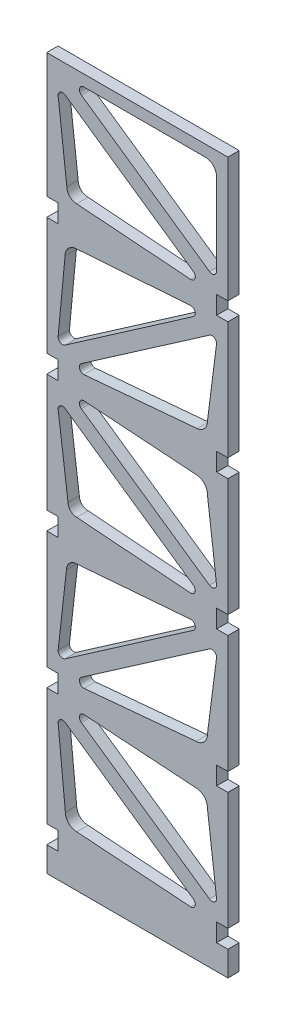
from build123d import *

# Parameters (mm, degrees)
MODEL_W             = 101.6
MODEL_H             = 398.78
BOSS_EXTRUDE1_DEPTH = 6.35
SKETCH1_W           = 6.35
SKETCH1_H           = 10.16
CUT_EXTRUDE1_DEPTH  = 6.35


with BuildPart() as part:
    # Model → Boss-Extrude1 (new body)
    with BuildSketch(Plane.XY):
        with Locations((50.8, 199.39)):
            Rectangle(MODEL_W, MODEL_H)
        with BuildLine():
            Line((83.820574672, 83.411866713), (20.83121403, 87.63))
            ThreePointArc((20.83121403, 87.63), (18.406749642, 85.847345646), (19.385420684, 83.001631833))
            Line((19.385420684, 83.001631833), (91.264206654, 33.239395393))
            ThreePointArc((91.264206654, 33.239395393), (93.888830968, 33.077884107), (95.25, 35.32776356))
            Line((95.25, 35.32776356), (90.076491123, 77.061866713))
            ThreePointArc((90.076491123, 77.061866713), (88.249801524, 81.518855344), (83.820574672, 83.411866713))
        make_face(mode=Mode.SUBTRACT)
        with BuildLine():
            Line((11.034694705, 153.003483907), (6.35, 111.52776356))
            ThreePointArc((6.35, 111.52776356), (7.711169032, 109.277884107), (10.335793346, 109.439395393))
            Line((10.335793346, 109.439395393), (82.214579316, 159.201631833))
            ThreePointArc((82.214579316, 159.201631833), (83.193250358, 162.047345646), (80.76878597, 163.83))
            Line((80.76878597, 163.83), (16.773036865, 158.741826067))
            ThreePointArc((16.773036865, 158.741826067), (12.715416211, 157.061104561), (11.034694705, 153.003483907))
        make_face(mode=Mode.SUBTRACT)
        with BuildLine():
            Line((84.100188096, 235.630146894), (20.83121403, 240.03))
            ThreePointArc((20.83121403, 240.03), (18.406749642, 238.247345646), (19.385420684, 235.401631833))
            Line((19.385420684, 235.401631833), (91.264206654, 185.639395393))
            ThreePointArc((91.264206654, 185.639395393), (93.888830968, 185.477884107), (95.25, 187.72776356))
            Line((95.25, 187.72776356), (90.086811771, 229.280146894))
            ThreePointArc((90.086811771, 229.280146894), (88.354189205, 233.643693703), (84.100188096, 235.630146894))
        make_face(mode=Mode.SUBTRACT)
        with BuildLine():
            Line((16.773036865, 181.402479512), (80.76878597, 176.53))
            ThreePointArc((80.76878597, 176.53), (83.193250358, 178.312654354), (82.214579316, 181.158368167))
            Line((82.214579316, 181.158368167), (10.335793346, 230.920604607))
            ThreePointArc((10.335793346, 230.920604607), (7.711169032, 231.082115893), (6.35, 228.83223644))
            Line((6.35, 228.83223644), (11.910018955, 186.265497422))
            ThreePointArc((11.910018955, 186.265497422), (13.334363923, 182.826824481), (16.773036865, 181.402479512))
        make_face(mode=Mode.SUBTRACT)
        with BuildLine():
            Line((91.264206654, 154.720604607), (19.385420684, 104.958368167))
            ThreePointArc((19.385420684, 104.958368167), (18.406749642, 102.112654354), (20.83121403, 100.33))
            Line((20.83121403, 100.33), (83.725783656, 106.06798896))
            ThreePointArc((83.725783656, 106.06798896), (88.215911716, 107.9278609), (90.075783656, 112.41798896))
            Line((90.075783656, 112.41798896), (95.25, 152.63223644))
            ThreePointArc((95.25, 152.63223644), (93.888830968, 154.882115893), (91.264206654, 154.720604607))
        make_face(mode=Mode.SUBTRACT)
        with BuildLine():
            Line((10.271454318, 305.232761919), (6.35, 263.92776356))
            ThreePointArc((6.35, 263.92776356), (7.711169032, 261.677884107), (10.335793346, 261.839395393))
            Line((10.335793346, 261.839395393), (82.214579316, 311.601631833))
            ThreePointArc((82.214579316, 311.601631833), (83.193250358, 314.447345646), (80.76878597, 316.23))
            Line((80.76878597, 316.23), (16.773036865, 311.734344465))
            ThreePointArc((16.773036865, 311.734344465), (12.175723757, 309.830075026), (10.271454318, 305.232761919))
        make_face(mode=Mode.SUBTRACT)
        with BuildLine():
            Line((88.9, 392.43), (20.83121403, 392.43))
            ThreePointArc((20.83121403, 392.43), (18.406749642, 390.647345646), (19.385420684, 387.801631833))
            Line((19.385420684, 387.801631833), (91.264206654, 338.039395393))
            ThreePointArc((91.264206654, 338.039395393), (93.888830968, 337.877884107), (95.25, 340.12776356))
            Line((95.25, 340.12776356), (95.25, 386.08))
            ThreePointArc((95.25, 386.08), (93.390128061, 390.570128061), (88.9, 392.43))
        make_face(mode=Mode.SUBTRACT)
        with BuildLine():
            Line((16.773036865, 333.700240414), (80.76878597, 328.93))
            ThreePointArc((80.76878597, 328.93), (83.193250358, 330.712654354), (82.214579316, 333.558368167))
            Line((82.214579316, 333.558368167), (10.335793346, 383.320604607))
            ThreePointArc((10.335793346, 383.320604607), (7.711169032, 383.482115893), (6.35, 381.23223644))
            Line((6.35, 381.23223644), (11.254237586, 339.219039692))
            ThreePointArc((11.254237586, 339.219039692), (12.870656471, 335.316659298), (16.773036865, 333.700240414))
        make_face(mode=Mode.SUBTRACT)
        with BuildLine():
            Line((16.773036865, 28.615297102), (80.76878597, 24.13))
            ThreePointArc((80.76878597, 24.13), (83.193250358, 25.912654354), (82.214579316, 28.758368167))
            Line((82.214579316, 28.758368167), (10.335793346, 78.520604607))
            ThreePointArc((10.335793346, 78.520604607), (7.711169032, 78.682115893), (6.35, 76.43223644))
            Line((6.35, 76.43223644), (10.423036865, 34.965297102))
            ThreePointArc((10.423036865, 34.965297102), (12.282908804, 30.475169041), (16.773036865, 28.615297102))
        make_face(mode=Mode.SUBTRACT)
        with BuildLine():
            Line((91.264206654, 307.120604607), (19.385420684, 257.358368167))
            ThreePointArc((19.385420684, 257.358368167), (18.406749642, 254.512654354), (20.83121403, 252.73))
            Line((20.83121403, 252.73), (84.309327563, 258.27471682))
            ThreePointArc((84.309327563, 258.27471682), (88.4366297, 260.326932153), (90.102540158, 264.62471682))
            Line((90.102540158, 264.62471682), (95.25, 305.03223644))
            ThreePointArc((95.25, 305.03223644), (93.888830968, 307.282115893), (91.264206654, 307.120604607))
        make_face(mode=Mode.SUBTRACT)
    extrude(amount=BOSS_EXTRUDE1_DEPTH)

    # Sketch1 → Cut-Extrude1 (cut)
    with BuildSketch(Plane.XY.offset(6.35)):
        with Locations((98.425, 19.05)):
            Rectangle(SKETCH1_W, SKETCH1_H)
        with Locations((3.175, 95.25)):
            Rectangle(SKETCH1_W, SKETCH1_H)
        with Locations((98.425, 171.45)):
            Rectangle(SKETCH1_W, SKETCH1_H)
        with Locations((3.175, 171.45)):
            Rectangle(SKETCH1_W, SKETCH1_H)
        with Locations((98.425, 247.65)):
            Rectangle(SKETCH1_W, SKETCH1_H)
        with Locations((3.175, 323.85)):
            Rectangle(SKETCH1_W, SKETCH1_H)
        with Locations((3.175, 19.05)):
            Rectangle(SKETCH1_W, SKETCH1_H)
        with Locations((98.425, 95.25)):
            Rectangle(SKETCH1_W, SKETCH1_H)
        with Locations((3.175, 247.65)):
            Rectangle(SKETCH1_W, SKETCH1_H)
        with Locations((98.425, 323.85)):
            Rectangle(SKETCH1_W, SKETCH1_H)
    extrude(amount=-CUT_EXTRUDE1_DEPTH, mode=Mode.SUBTRACT)


solid = part.part
